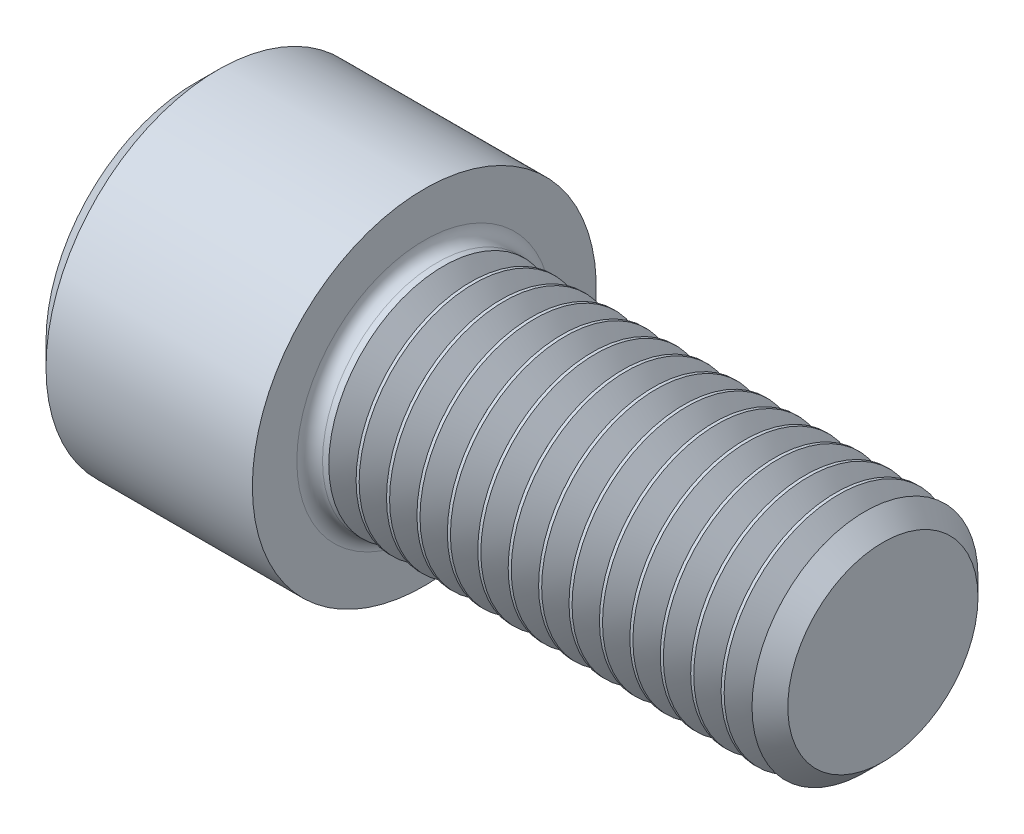
from build123d import *

# Parameters (mm, degrees)
SKETCH1_W            = 6.35
SKETCH1_H            = 4.7625
SKETCH2_R            = 3.175
BOSS_EXTRUDE1_DEPTH  = 0.527953718
SKETCH3_R            = 3.175
BOSS_EXTRUDE2_DEPTH  = 0.378826282
BOSS_EXTRUDE2_TAPER  = 55
SKETCH4_R            = 2.63398
BOSS_EXTRUDE3_DEPTH  = 0.378826282
BOSS_EXTRUDE3_DRAFT  = -54.999999998
SKETCH5_R            = 3.175
BOSS_EXTRUDE4_DEPTH  = 0.084720292
SKETCH6_R            = 3.175
BOSS_EXTRUDE5_DEPTH  = 0.378826282
BOSS_EXTRUDE5_TAPER  = 55
SKETCH7_R            = 2.63398
BOSS_EXTRUDE6_DEPTH  = 0.378826282
BOSS_EXTRUDE6_DRAFT  = -55
SKETCH8_R            = 3.175
BOSS_EXTRUDE7_DEPTH  = 0.084720293
SKETCH9_R            = 3.175
BOSS_EXTRUDE8_DEPTH  = 0.378826282
BOSS_EXTRUDE8_TAPER  = 55
SKETCH10_R           = 2.63398
BOSS_EXTRUDE9_DEPTH  = 0.378826282
BOSS_EXTRUDE9_DRAFT  = -55
SKETCH11_R           = 3.175
BOSS_EXTRUDE10_DEPTH = 0.084720292
SKETCH12_R           = 3.175
BOSS_EXTRUDE11_DEPTH = 0.378826282
BOSS_EXTRUDE11_TAPER = 55
SKETCH13_R           = 2.63398
BOSS_EXTRUDE12_DEPTH = 0.378826282
BOSS_EXTRUDE12_DRAFT = -55
SKETCH14_R           = 3.175
BOSS_EXTRUDE13_DEPTH = 0.084720293
SKETCH15_R           = 3.175
BOSS_EXTRUDE14_DEPTH = 0.378826282
BOSS_EXTRUDE14_TAPER = 55
SKETCH16_R           = 2.63398
BOSS_EXTRUDE15_DEPTH = 0.378826282
BOSS_EXTRUDE15_DRAFT = -55
SKETCH17_R           = 3.175
BOSS_EXTRUDE16_DEPTH = 0.084720292
SKETCH18_R           = 3.175
BOSS_EXTRUDE17_DEPTH = 0.378826282
BOSS_EXTRUDE17_TAPER = 55
SKETCH19_R           = 2.63398
BOSS_EXTRUDE18_DEPTH = 0.378826282
BOSS_EXTRUDE18_DRAFT = -55
SKETCH20_R           = 3.175
BOSS_EXTRUDE19_DEPTH = 0.084720292
SKETCH21_R           = 3.175
BOSS_EXTRUDE20_DEPTH = 0.378826282
BOSS_EXTRUDE20_TAPER = 55
SKETCH22_R           = 2.63398
BOSS_EXTRUDE21_DEPTH = 0.378826282
BOSS_EXTRUDE21_DRAFT = -55
SKETCH23_R           = 3.175
BOSS_EXTRUDE22_DEPTH = 0.084720293
SKETCH24_R           = 3.175
BOSS_EXTRUDE23_DEPTH = 0.378826282
BOSS_EXTRUDE23_TAPER = 55
SKETCH25_R           = 2.63398
BOSS_EXTRUDE24_DEPTH = 0.378826282
BOSS_EXTRUDE24_DRAFT = -55
SKETCH26_R           = 3.175
BOSS_EXTRUDE25_DEPTH = 0.084720292
SKETCH27_R           = 3.175
BOSS_EXTRUDE26_DEPTH = 0.378826282
BOSS_EXTRUDE26_TAPER = 55
SKETCH28_R           = 2.63398
BOSS_EXTRUDE27_DEPTH = 0.378826282
BOSS_EXTRUDE27_DRAFT = -55
SKETCH29_R           = 3.175
BOSS_EXTRUDE28_DEPTH = 0.084720292
SKETCH30_R           = 3.175
BOSS_EXTRUDE29_DEPTH = 0.378826282
BOSS_EXTRUDE29_TAPER = 55
SKETCH31_R           = 2.63398
BOSS_EXTRUDE30_DEPTH = 0.378826282
BOSS_EXTRUDE30_DRAFT = -55
SKETCH32_R           = 3.175
BOSS_EXTRUDE31_DEPTH = 0.084720293
SKETCH33_R           = 3.175
BOSS_EXTRUDE32_DEPTH = 0.378826282
BOSS_EXTRUDE32_TAPER = 55
SKETCH34_R           = 2.63398
BOSS_EXTRUDE33_DEPTH = 0.378826282
BOSS_EXTRUDE33_DRAFT = -55
SKETCH35_R           = 3.175
BOSS_EXTRUDE34_DEPTH = 0.084720292
SKETCH36_R           = 3.175
BOSS_EXTRUDE35_DEPTH = 0.378826282
BOSS_EXTRUDE35_TAPER = 55
SKETCH37_R           = 2.63398
BOSS_EXTRUDE36_DEPTH = 0.378826282
BOSS_EXTRUDE36_DRAFT = -55
SKETCH38_R           = 3.175
BOSS_EXTRUDE37_DEPTH = 0.084720293
SKETCH39_R           = 3.175
BOSS_EXTRUDE38_DEPTH = 0.378826282
BOSS_EXTRUDE38_TAPER = 55
SKETCH40_R           = 2.63398
BOSS_EXTRUDE39_DEPTH = 0.378826282
BOSS_EXTRUDE39_DRAFT = -55
SKETCH41_R           = 3.175
BOSS_EXTRUDE40_DEPTH = 0.084720292
SKETCH42_R           = 3.175
BOSS_EXTRUDE41_DEPTH = 0.378826282
BOSS_EXTRUDE41_TAPER = 55
SKETCH43_R           = 2.63398
BOSS_EXTRUDE42_DEPTH = 0.346919897
BOSS_EXTRUDE42_DRAFT = -55.000000002
SKETCH44_R           = 3.12943296
BOSS_EXTRUDE43_DEPTH = 0.49545296
BOSS_EXTRUDE43_TAPER = 45
CUT_EXTRUDE1_DEPTH   = 3.048
CHAMFER1_SIZE        = 0.635
FILLET1_R            = 0.3556


with BuildPart() as part:
    # Sketch1 → Revolve1 (revolve)
    with BuildSketch(Plane(origin=(0, 0, 0), x_dir=(-1, 0, 0), z_dir=(0, 0, -1)), mode=Mode.PRIVATE) as revolve1_sk:
        with Locations((-3.175, 2.38125)):
            Rectangle(SKETCH1_W, SKETCH1_H)
    revolve(revolve1_sk.sketch.rotate(Axis((6.35, 0, 0), (-1, 0, 0)), 270), axis=Axis((6.35, 0, 0), (-1, 0, 0)))

    # Sketch2 → Boss-Extrude1 (add)
    with BuildSketch(Plane(origin=(6.35, 0, 0), x_dir=(0, 0, -1), z_dir=(1, 0, 0))):
        Circle(SKETCH2_R)
    extrude(amount=BOSS_EXTRUDE1_DEPTH)

    # Sketch3 → Boss-Extrude2 (add)
    with BuildSketch(Plane(origin=(6.877953718, 0, 0), x_dir=(0, 0, -1), z_dir=(1, 0, 0))):
        Circle(SKETCH3_R)
    extrude(amount=BOSS_EXTRUDE2_DEPTH, taper=BOSS_EXTRUDE2_TAPER)


with BuildPart() as boss_extrude3_tool:
    # Sketch4 → Boss-Extrude3 (with draft: the straight prism first)
    with BuildSketch(Plane(origin=(7.25678, 0, 0), x_dir=(0, 0, -1), z_dir=(1, 0, 0))):
        Circle(SKETCH4_R)
    extrude(amount=BOSS_EXTRUDE3_DEPTH)
    # Boss-Extrude3: the draft: its side faces are tilted about the plane it starts from
    boss_extrude3_sides = [boss_extrude3_tool.faces().sort_by_distance(p)[0] for p in [
        (7.446193141, 0, 2.63398),
    ]]
    draft(boss_extrude3_sides, Plane(origin=(7.25678, 0, 0), x_dir=(0, 0, -1), z_dir=(1, 0, 0)), BOSS_EXTRUDE3_DRAFT)


with BuildPart() as part_1:
    add(part.part)

    # Boss-Extrude3: add boss_extrude3_tool
    add(boss_extrude3_tool.part)

    # Sketch5 → Boss-Extrude4 (add)
    with BuildSketch(Plane(origin=(7.635606282, 0, 0), x_dir=(0, 0, -1), z_dir=(1, 0, 0))):
        Circle(SKETCH5_R)
    extrude(amount=BOSS_EXTRUDE4_DEPTH)

    # Sketch6 → Boss-Extrude5 (add)
    with BuildSketch(Plane(origin=(7.720326575, 0, 0), x_dir=(0, 0, -1), z_dir=(1, 0, 0))):
        Circle(SKETCH6_R)
    extrude(amount=BOSS_EXTRUDE5_DEPTH, taper=BOSS_EXTRUDE5_TAPER)


with BuildPart() as boss_extrude6_tool:
    # Sketch7 → Boss-Extrude6 (with draft: the straight prism first)
    with BuildSketch(Plane(origin=(8.099152857, 0, 0), x_dir=(0, 0, -1), z_dir=(1, 0, 0))):
        Circle(SKETCH7_R)
    extrude(amount=BOSS_EXTRUDE6_DEPTH)
    # Boss-Extrude6: the draft: its side faces are tilted about the plane it starts from
    boss_extrude6_sides = [boss_extrude6_tool.faces().sort_by_distance(p)[0] for p in [
        (8.288565998, 0, 2.63398),
    ]]
    draft(boss_extrude6_sides, Plane(origin=(8.099152857, 0, 0), x_dir=(0, 0, -1), z_dir=(1, 0, 0)), BOSS_EXTRUDE6_DRAFT)


with BuildPart() as part_2:
    add(part_1.part)

    # Boss-Extrude6: add boss_extrude6_tool
    add(boss_extrude6_tool.part)

    # Sketch8 → Boss-Extrude7 (add)
    with BuildSketch(Plane(origin=(8.477979139, 0, 0), x_dir=(0, 0, -1), z_dir=(1, 0, 0))):
        Circle(SKETCH8_R)
    extrude(amount=BOSS_EXTRUDE7_DEPTH)

    # Sketch9 → Boss-Extrude8 (add)
    with BuildSketch(Plane(origin=(8.562699432, 0, 0), x_dir=(0, 0, -1), z_dir=(1, 0, 0))):
        Circle(SKETCH9_R)
    extrude(amount=BOSS_EXTRUDE8_DEPTH, taper=BOSS_EXTRUDE8_TAPER)


with BuildPart() as boss_extrude9_tool:
    # Sketch10 → Boss-Extrude9 (with draft: the straight prism first)
    with BuildSketch(Plane(origin=(8.941525714, 0, 0), x_dir=(0, 0, -1), z_dir=(1, 0, 0))):
        Circle(SKETCH10_R)
    extrude(amount=BOSS_EXTRUDE9_DEPTH)
    # Boss-Extrude9: the draft: its side faces are tilted about the plane it starts from
    boss_extrude9_sides = [boss_extrude9_tool.faces().sort_by_distance(p)[0] for p in [
        (9.130938855, 0, 2.63398),
    ]]
    draft(boss_extrude9_sides, Plane(origin=(8.941525714, 0, 0), x_dir=(0, 0, -1), z_dir=(1, 0, 0)), BOSS_EXTRUDE9_DRAFT)


with BuildPart() as part_3:
    add(part_2.part)

    # Boss-Extrude9: add boss_extrude9_tool
    add(boss_extrude9_tool.part)

    # Sketch11 → Boss-Extrude10 (add)
    with BuildSketch(Plane(origin=(9.320351997, 0, 0), x_dir=(0, 0, -1), z_dir=(1, 0, 0))):
        Circle(SKETCH11_R)
    extrude(amount=BOSS_EXTRUDE10_DEPTH)

    # Sketch12 → Boss-Extrude11 (add)
    with BuildSketch(Plane(origin=(9.405072289, 0, 0), x_dir=(0, 0, -1), z_dir=(1, 0, 0))):
        Circle(SKETCH12_R)
    extrude(amount=BOSS_EXTRUDE11_DEPTH, taper=BOSS_EXTRUDE11_TAPER)


with BuildPart() as boss_extrude12_tool:
    # Sketch13 → Boss-Extrude12 (with draft: the straight prism first)
    with BuildSketch(Plane(origin=(9.783898571, 0, 0), x_dir=(0, 0, -1), z_dir=(1, 0, 0))):
        Circle(SKETCH13_R)
    extrude(amount=BOSS_EXTRUDE12_DEPTH)
    # Boss-Extrude12: the draft: its side faces are tilted about the plane it starts from
    boss_extrude12_sides = [boss_extrude12_tool.faces().sort_by_distance(p)[0] for p in [
        (9.973311713, 0, 2.63398),
    ]]
    draft(boss_extrude12_sides, Plane(origin=(9.783898571, 0, 0), x_dir=(0, 0, -1), z_dir=(1, 0, 0)), BOSS_EXTRUDE12_DRAFT)


with BuildPart() as part_4:
    add(part_3.part)

    # Boss-Extrude12: add boss_extrude12_tool
    add(boss_extrude12_tool.part)

    # Sketch14 → Boss-Extrude13 (add)
    with BuildSketch(Plane(origin=(10.162724854, 0, 0), x_dir=(0, 0, -1), z_dir=(1, 0, 0))):
        Circle(SKETCH14_R)
    extrude(amount=BOSS_EXTRUDE13_DEPTH)

    # Sketch15 → Boss-Extrude14 (add)
    with BuildSketch(Plane(origin=(10.247445146, 0, 0), x_dir=(0, 0, -1), z_dir=(1, 0, 0))):
        Circle(SKETCH15_R)
    extrude(amount=BOSS_EXTRUDE14_DEPTH, taper=BOSS_EXTRUDE14_TAPER)


with BuildPart() as boss_extrude15_tool:
    # Sketch16 → Boss-Extrude15 (with draft: the straight prism first)
    with BuildSketch(Plane(origin=(10.626271429, 0, 0), x_dir=(0, 0, -1), z_dir=(1, 0, 0))):
        Circle(SKETCH16_R)
    extrude(amount=BOSS_EXTRUDE15_DEPTH)
    # Boss-Extrude15: the draft: its side faces are tilted about the plane it starts from
    boss_extrude15_sides = [boss_extrude15_tool.faces().sort_by_distance(p)[0] for p in [
        (10.81568457, 0, 2.63398),
    ]]
    draft(boss_extrude15_sides, Plane(origin=(10.626271429, 0, 0), x_dir=(0, 0, -1), z_dir=(1, 0, 0)), BOSS_EXTRUDE15_DRAFT)


with BuildPart() as part_5:
    add(part_4.part)

    # Boss-Extrude15: add boss_extrude15_tool
    add(boss_extrude15_tool.part)

    # Sketch17 → Boss-Extrude16 (add)
    with BuildSketch(Plane(origin=(11.005097711, 0, 0), x_dir=(0, 0, -1), z_dir=(1, 0, 0))):
        Circle(SKETCH17_R)
    extrude(amount=BOSS_EXTRUDE16_DEPTH)

    # Sketch18 → Boss-Extrude17 (add)
    with BuildSketch(Plane(origin=(11.089818003, 0, 0), x_dir=(0, 0, -1), z_dir=(1, 0, 0))):
        Circle(SKETCH18_R)
    extrude(amount=BOSS_EXTRUDE17_DEPTH, taper=BOSS_EXTRUDE17_TAPER)


with BuildPart() as boss_extrude18_tool:
    # Sketch19 → Boss-Extrude18 (with draft: the straight prism first)
    with BuildSketch(Plane(origin=(11.468644286, 0, 0), x_dir=(0, 0, -1), z_dir=(1, 0, 0))):
        Circle(SKETCH19_R)
    extrude(amount=BOSS_EXTRUDE18_DEPTH)
    # Boss-Extrude18: the draft: its side faces are tilted about the plane it starts from
    boss_extrude18_sides = [boss_extrude18_tool.faces().sort_by_distance(p)[0] for p in [
        (11.658057427, 0, 2.63398),
    ]]
    draft(boss_extrude18_sides, Plane(origin=(11.468644286, 0, 0), x_dir=(0, 0, -1), z_dir=(1, 0, 0)), BOSS_EXTRUDE18_DRAFT)


with BuildPart() as part_6:
    add(part_5.part)

    # Boss-Extrude18: add boss_extrude18_tool
    add(boss_extrude18_tool.part)

    # Sketch20 → Boss-Extrude19 (add)
    with BuildSketch(Plane(origin=(11.847470568, 0, 0), x_dir=(0, 0, -1), z_dir=(1, 0, 0))):
        Circle(SKETCH20_R)
    extrude(amount=BOSS_EXTRUDE19_DEPTH)

    # Sketch21 → Boss-Extrude20 (add)
    with BuildSketch(Plane(origin=(11.932190861, 0, 0), x_dir=(0, 0, -1), z_dir=(1, 0, 0))):
        Circle(SKETCH21_R)
    extrude(amount=BOSS_EXTRUDE20_DEPTH, taper=BOSS_EXTRUDE20_TAPER)


with BuildPart() as boss_extrude21_tool:
    # Sketch22 → Boss-Extrude21 (with draft: the straight prism first)
    with BuildSketch(Plane(origin=(12.311017143, 0, 0), x_dir=(0, 0, -1), z_dir=(1, 0, 0))):
        Circle(SKETCH22_R)
    extrude(amount=BOSS_EXTRUDE21_DEPTH)
    # Boss-Extrude21: the draft: its side faces are tilted about the plane it starts from
    boss_extrude21_sides = [boss_extrude21_tool.faces().sort_by_distance(p)[0] for p in [
        (12.500430284, 0, 2.63398),
    ]]
    draft(boss_extrude21_sides, Plane(origin=(12.311017143, 0, 0), x_dir=(0, 0, -1), z_dir=(1, 0, 0)), BOSS_EXTRUDE21_DRAFT)


with BuildPart() as part_7:
    add(part_6.part)

    # Boss-Extrude21: add boss_extrude21_tool
    add(boss_extrude21_tool.part)

    # Sketch23 → Boss-Extrude22 (add)
    with BuildSketch(Plane(origin=(12.689843425, 0, 0), x_dir=(0, 0, -1), z_dir=(1, 0, 0))):
        Circle(SKETCH23_R)
    extrude(amount=BOSS_EXTRUDE22_DEPTH)

    # Sketch24 → Boss-Extrude23 (add)
    with BuildSketch(Plane(origin=(12.774563718, 0, 0), x_dir=(0, 0, -1), z_dir=(1, 0, 0))):
        Circle(SKETCH24_R)
    extrude(amount=BOSS_EXTRUDE23_DEPTH, taper=BOSS_EXTRUDE23_TAPER)


with BuildPart() as boss_extrude24_tool:
    # Sketch25 → Boss-Extrude24 (with draft: the straight prism first)
    with BuildSketch(Plane(origin=(13.15339, 0, 0), x_dir=(0, 0, -1), z_dir=(1, 0, 0))):
        Circle(SKETCH25_R)
    extrude(amount=BOSS_EXTRUDE24_DEPTH)
    # Boss-Extrude24: the draft: its side faces are tilted about the plane it starts from
    boss_extrude24_sides = [boss_extrude24_tool.faces().sort_by_distance(p)[0] for p in [
        (13.342803141, 0, 2.63398),
    ]]
    draft(boss_extrude24_sides, Plane(origin=(13.15339, 0, 0), x_dir=(0, 0, -1), z_dir=(1, 0, 0)), BOSS_EXTRUDE24_DRAFT)


with BuildPart() as part_8:
    add(part_7.part)

    # Boss-Extrude24: add boss_extrude24_tool
    add(boss_extrude24_tool.part)

    # Sketch26 → Boss-Extrude25 (add)
    with BuildSketch(Plane(origin=(13.532216282, 0, 0), x_dir=(0, 0, -1), z_dir=(1, 0, 0))):
        Circle(SKETCH26_R)
    extrude(amount=BOSS_EXTRUDE25_DEPTH)

    # Sketch27 → Boss-Extrude26 (add)
    with BuildSketch(Plane(origin=(13.616936575, 0, 0), x_dir=(0, 0, -1), z_dir=(1, 0, 0))):
        Circle(SKETCH27_R)
    extrude(amount=BOSS_EXTRUDE26_DEPTH, taper=BOSS_EXTRUDE26_TAPER)


with BuildPart() as boss_extrude27_tool:
    # Sketch28 → Boss-Extrude27 (with draft: the straight prism first)
    with BuildSketch(Plane(origin=(13.995762857, 0, 0), x_dir=(0, 0, -1), z_dir=(1, 0, 0))):
        Circle(SKETCH28_R)
    extrude(amount=BOSS_EXTRUDE27_DEPTH)
    # Boss-Extrude27: the draft: its side faces are tilted about the plane it starts from
    boss_extrude27_sides = [boss_extrude27_tool.faces().sort_by_distance(p)[0] for p in [
        (14.185175998, 0, 2.63398),
    ]]
    draft(boss_extrude27_sides, Plane(origin=(13.995762857, 0, 0), x_dir=(0, 0, -1), z_dir=(1, 0, 0)), BOSS_EXTRUDE27_DRAFT)


with BuildPart() as part_9:
    add(part_8.part)

    # Boss-Extrude27: add boss_extrude27_tool
    add(boss_extrude27_tool.part)

    # Sketch29 → Boss-Extrude28 (add)
    with BuildSketch(Plane(origin=(14.374589139, 0, 0), x_dir=(0, 0, -1), z_dir=(1, 0, 0))):
        Circle(SKETCH29_R)
    extrude(amount=BOSS_EXTRUDE28_DEPTH)

    # Sketch30 → Boss-Extrude29 (add)
    with BuildSketch(Plane(origin=(14.459309432, 0, 0), x_dir=(0, 0, -1), z_dir=(1, 0, 0))):
        Circle(SKETCH30_R)
    extrude(amount=BOSS_EXTRUDE29_DEPTH, taper=BOSS_EXTRUDE29_TAPER)


with BuildPart() as boss_extrude30_tool:
    # Sketch31 → Boss-Extrude30 (with draft: the straight prism first)
    with BuildSketch(Plane(origin=(14.838135714, 0, 0), x_dir=(0, 0, -1), z_dir=(1, 0, 0))):
        Circle(SKETCH31_R)
    extrude(amount=BOSS_EXTRUDE30_DEPTH)
    # Boss-Extrude30: the draft: its side faces are tilted about the plane it starts from
    boss_extrude30_sides = [boss_extrude30_tool.faces().sort_by_distance(p)[0] for p in [
        (15.027548855, 0, 2.63398),
    ]]
    draft(boss_extrude30_sides, Plane(origin=(14.838135714, 0, 0), x_dir=(0, 0, -1), z_dir=(1, 0, 0)), BOSS_EXTRUDE30_DRAFT)


with BuildPart() as part_10:
    add(part_9.part)

    # Boss-Extrude30: add boss_extrude30_tool
    add(boss_extrude30_tool.part)

    # Sketch32 → Boss-Extrude31 (add)
    with BuildSketch(Plane(origin=(15.216961997, 0, 0), x_dir=(0, 0, -1), z_dir=(1, 0, 0))):
        Circle(SKETCH32_R)
    extrude(amount=BOSS_EXTRUDE31_DEPTH)

    # Sketch33 → Boss-Extrude32 (add)
    with BuildSketch(Plane(origin=(15.301682289, 0, 0), x_dir=(0, 0, -1), z_dir=(1, 0, 0))):
        Circle(SKETCH33_R)
    extrude(amount=BOSS_EXTRUDE32_DEPTH, taper=BOSS_EXTRUDE32_TAPER)


with BuildPart() as boss_extrude33_tool:
    # Sketch34 → Boss-Extrude33 (with draft: the straight prism first)
    with BuildSketch(Plane(origin=(15.680508571, 0, 0), x_dir=(0, 0, -1), z_dir=(1, 0, 0))):
        Circle(SKETCH34_R)
    extrude(amount=BOSS_EXTRUDE33_DEPTH)
    # Boss-Extrude33: the draft: its side faces are tilted about the plane it starts from
    boss_extrude33_sides = [boss_extrude33_tool.faces().sort_by_distance(p)[0] for p in [
        (15.869921713, 0, 2.63398),
    ]]
    draft(boss_extrude33_sides, Plane(origin=(15.680508571, 0, 0), x_dir=(0, 0, -1), z_dir=(1, 0, 0)), BOSS_EXTRUDE33_DRAFT)


with BuildPart() as part_11:
    add(part_10.part)

    # Boss-Extrude33: add boss_extrude33_tool
    add(boss_extrude33_tool.part)

    # Sketch35 → Boss-Extrude34 (add)
    with BuildSketch(Plane(origin=(16.059334854, 0, 0), x_dir=(0, 0, -1), z_dir=(1, 0, 0))):
        Circle(SKETCH35_R)
    extrude(amount=BOSS_EXTRUDE34_DEPTH)

    # Sketch36 → Boss-Extrude35 (add)
    with BuildSketch(Plane(origin=(16.144055146, 0, 0), x_dir=(0, 0, -1), z_dir=(1, 0, 0))):
        Circle(SKETCH36_R)
    extrude(amount=BOSS_EXTRUDE35_DEPTH, taper=BOSS_EXTRUDE35_TAPER)


with BuildPart() as boss_extrude36_tool:
    # Sketch37 → Boss-Extrude36 (with draft: the straight prism first)
    with BuildSketch(Plane(origin=(16.522881429, 0, 0), x_dir=(0, 0, -1), z_dir=(1, 0, 0))):
        Circle(SKETCH37_R)
    extrude(amount=BOSS_EXTRUDE36_DEPTH)
    # Boss-Extrude36: the draft: its side faces are tilted about the plane it starts from
    boss_extrude36_sides = [boss_extrude36_tool.faces().sort_by_distance(p)[0] for p in [
        (16.71229457, 0, 2.63398),
    ]]
    draft(boss_extrude36_sides, Plane(origin=(16.522881429, 0, 0), x_dir=(0, 0, -1), z_dir=(1, 0, 0)), BOSS_EXTRUDE36_DRAFT)


with BuildPart() as part_12:
    add(part_11.part)

    # Boss-Extrude36: add boss_extrude36_tool
    add(boss_extrude36_tool.part)

    # Sketch38 → Boss-Extrude37 (add)
    with BuildSketch(Plane(origin=(16.901707711, 0, 0), x_dir=(0, 0, -1), z_dir=(1, 0, 0))):
        Circle(SKETCH38_R)
    extrude(amount=BOSS_EXTRUDE37_DEPTH)

    # Sketch39 → Boss-Extrude38 (add)
    with BuildSketch(Plane(origin=(16.986428003, 0, 0), x_dir=(0, 0, -1), z_dir=(1, 0, 0))):
        Circle(SKETCH39_R)
    extrude(amount=BOSS_EXTRUDE38_DEPTH, taper=BOSS_EXTRUDE38_TAPER)


with BuildPart() as boss_extrude39_tool:
    # Sketch40 → Boss-Extrude39 (with draft: the straight prism first)
    with BuildSketch(Plane(origin=(17.365254286, 0, 0), x_dir=(0, 0, -1), z_dir=(1, 0, 0))):
        Circle(SKETCH40_R)
    extrude(amount=BOSS_EXTRUDE39_DEPTH)
    # Boss-Extrude39: the draft: its side faces are tilted about the plane it starts from
    boss_extrude39_sides = [boss_extrude39_tool.faces().sort_by_distance(p)[0] for p in [
        (17.554667427, 0, 2.63398),
    ]]
    draft(boss_extrude39_sides, Plane(origin=(17.365254286, 0, 0), x_dir=(0, 0, -1), z_dir=(1, 0, 0)), BOSS_EXTRUDE39_DRAFT)


with BuildPart() as part_13:
    add(part_12.part)

    # Boss-Extrude39: add boss_extrude39_tool
    add(boss_extrude39_tool.part)

    # Sketch41 → Boss-Extrude40 (add)
    with BuildSketch(Plane(origin=(17.744080568, 0, 0), x_dir=(0, 0, -1), z_dir=(1, 0, 0))):
        Circle(SKETCH41_R)
    extrude(amount=BOSS_EXTRUDE40_DEPTH)

    # Sketch42 → Boss-Extrude41 (add)
    with BuildSketch(Plane(origin=(17.828800861, 0, 0), x_dir=(0, 0, -1), z_dir=(1, 0, 0))):
        Circle(SKETCH42_R)
    extrude(amount=BOSS_EXTRUDE41_DEPTH, taper=BOSS_EXTRUDE41_TAPER)


with BuildPart() as boss_extrude42_tool:
    # Sketch43 → Boss-Extrude42 (with draft: the straight prism first)
    with BuildSketch(Plane(origin=(18.207627143, 0, 0), x_dir=(0, 0, -1), z_dir=(1, 0, 0))):
        Circle(SKETCH43_R)
    extrude(amount=BOSS_EXTRUDE42_DEPTH)
    # Boss-Extrude42: the draft: its side faces are tilted about the plane it starts from
    boss_extrude42_sides = [boss_extrude42_tool.faces().sort_by_distance(p)[0] for p in [
        (18.381087092, 0, 2.63398),
    ]]
    draft(boss_extrude42_sides, Plane(origin=(18.207627143, 0, 0), x_dir=(0, 0, -1), z_dir=(1, 0, 0)), BOSS_EXTRUDE42_DRAFT)


with BuildPart() as part_14:
    add(part_13.part)

    # Boss-Extrude42: add boss_extrude42_tool
    add(boss_extrude42_tool.part)

    # Sketch44 → Boss-Extrude43 (add)
    with BuildSketch(Plane(origin=(18.55454704, 0, 0), x_dir=(0, 0, -1), z_dir=(1, 0, 0))):
        Circle(SKETCH44_R)
    extrude(amount=BOSS_EXTRUDE43_DEPTH, taper=BOSS_EXTRUDE43_TAPER)

    # Sketch45 → Cut-Extrude1 (cut)
    with BuildSketch(Plane.ZY):
        Polygon((-2.38125, -1.374815329), (0, -2.749630657), (2.38125, -1.374815329), (2.38125, 1.374815329), (0, 2.749630657), (-2.38125, 1.374815329), align=None)
    extrude(amount=-CUT_EXTRUDE1_DEPTH, mode=Mode.SUBTRACT)

    # Sketch46 → Cut-Revolve1 (revolve, cut)
    with BuildSketch(Plane.XY, mode=Mode.PRIVATE) as cut_revolve1_sk:
        Polygon((3.048, 2.38125), (3.048, 0), (4.422815329, 0), align=None)
    revolve(cut_revolve1_sk.sketch.rotate(Axis((3.047975, 0, 0), (1, 0, 0)), 90), axis=Axis((3.047975, 0, 0), (1, 0, 0)), mode=Mode.SUBTRACT)

    # Chamfer1
    chamfer1_edges = [part_14.edges().sort_by_distance(p)[0] for p in [
        (0, 0, -4.7625),
    ]]
    chamfer(chamfer1_edges, length=CHAMFER1_SIZE)

    # Fillet1
    fillet1_edges = [part_14.edges().sort_by_distance(p)[0] for p in [
        (6.35, 0, 3.175),
    ]]
    fillet(fillet1_edges, radius=FILLET1_R)


solid = part_14.part
